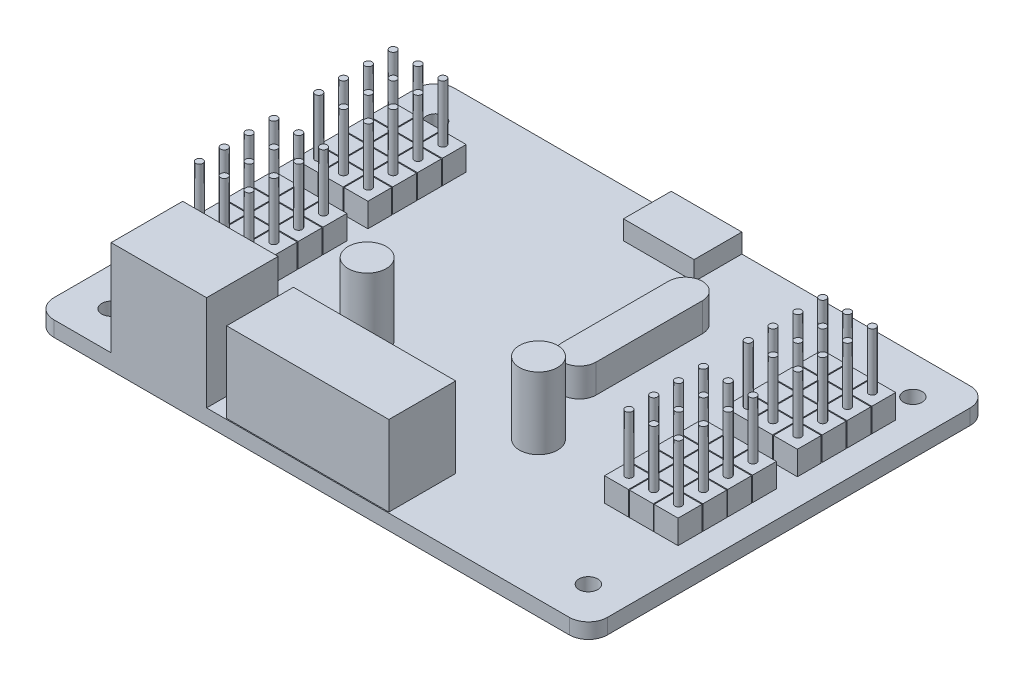
from build123d import *

# Parameters (mm, degrees)
SKETCH_1_W                  = 58
SKETCH_1_H                  = 42
EXTRUDE_1_DEPTH             = 1.6
SKETCH_2_W                  = 10
SKETCH_2_H                  = 7.5
EXTRUDE_2_DEPTH             = 10
SKETCH_4_W                  = 17
SKETCH_4_H                  = 7
EXTRUDE_3_DEPTH             = 8.4
SKETCH_5_R                  = 0.978239546
CUT_EXTRUDE_1_DEPTH         = 73.30490993
FILLET_1_R                  = 2
SKETCH_6_W                  = 7.4
SKETCH_6_H                  = 5
EXTRUDE_4_DEPTH             = 2
SKETCH_7_W                  = 2.5
SKETCH_7_H                  = 2.5
EXTRUDE_5_DEPTH             = 2.5
PATTERN_LINEAR_1_COUNT      = 2
PATTERN_LINEAR_1_PITCH      = 45
PATTERN_LINEAR_1_COUNT_DIR2 = 2
PATTERN_LINEAR_1_PITCH_DIR2 = 12.5
SKETCH_8_R                  = 0.375
EXTRUDE_6_DEPTH             = 6
PATTERN_LINEAR_2_COUNT      = 2
PATTERN_LINEAR_2_PITCH      = 45
PATTERN_LINEAR_2_COUNT_DIR2 = 2
PATTERN_LINEAR_2_PITCH_DIR2 = 12.5
SKETCH_9_R                  = 2
EXTRUDE_7_DEPTH             = 7.5
EXTRUDE_8_DEPTH             = 3
SKETCH_11_W                 = 44.835489636
SKETCH_11_H                 = 29.304241592
EXTRUDE_9_DEPTH             = 1.6


with BuildPart() as part:
    # 草图1 → 凸台-拉伸1 (new body)
    with BuildSketch(Plane(origin=(0, 0, 0), x_dir=(1, 0, 0), z_dir=(0, 1, 0))):
        with Locations((29, 21)):
            Rectangle(SKETCH_1_W, SKETCH_1_H)
    extrude(amount=EXTRUDE_1_DEPTH)

    # 草图2 → 凸台-拉伸2 (add)
    with BuildSketch(Plane(origin=(0, 1.6, 0), x_dir=(1, 0, 0), z_dir=(0, 1, 0))):
        with Locations((13, 3.75)):
            Rectangle(SKETCH_2_W, SKETCH_2_H)
    extrude(amount=EXTRUDE_2_DEPTH)

    # 草图4 → 凸台-拉伸3 (add)
    with BuildSketch(Plane(origin=(0, 1.6, 0), x_dir=(1, 0, 0), z_dir=(0, 1, 0))):
        with Locations((28.5, 3.6)):
            Rectangle(SKETCH_4_W, SKETCH_4_H)
    extrude(amount=EXTRUDE_3_DEPTH)

    # 草图5 → 切除-拉伸1 (cut, through all)
    with BuildSketch(Plane(origin=(0, 1.6, 0), x_dir=(1, 0, 0), z_dir=(0, 1, 0))):
        with Locations(Location((4, 38, 0), (0, 0, 270))):
            Circle(SKETCH_5_R)
        with Locations(Location((54, 38, 0), (0, 0, 90))):
            Circle(SKETCH_5_R)
        with Locations(Location((54, 4, 0), (0, 0, 270))):
            Circle(SKETCH_5_R)
        with Locations(Location((4, 4, 0), (0, 0, 90))):
            Circle(SKETCH_5_R)
    extrude(amount=-CUT_EXTRUDE_1_DEPTH, mode=Mode.SUBTRACT)

    # 圆角1
    fillet_1_edges = [part.edges().sort_by_distance(p)[0] for p in [
        (0, 0.8, -42),
        (58, 0.8, -42),
        (58, 0.8, 0),
        (0, 0.8, 0),
    ]]
    fillet(fillet_1_edges, radius=FILLET_1_R)

    # 草图6 → 凸台-拉伸4 (add)
    with BuildSketch(Plane(origin=(0, 1.6, 0), x_dir=(1, 0, 0), z_dir=(0, 1, 0))):
        with Locations((28.38022734, 39.5)):
            Rectangle(SKETCH_6_W, SKETCH_6_H)
    extrude(amount=EXTRUDE_4_DEPTH)

    # 草图7 → 凸台-拉伸5 (add)
    with BuildSketch(Plane(origin=(0, 1.6, 0), x_dir=(1, 0, 0), z_dir=(0, 1, 0))):
        with Locations((3.75, 33.75)):
            Rectangle(SKETCH_7_W, SKETCH_7_H)
        with Locations((6.35, 33.75)):
            Rectangle(SKETCH_7_W, SKETCH_7_H)
        with Locations((8.95, 33.75)):
            Rectangle(SKETCH_7_W, SKETCH_7_H)
        with Locations((6.35, 31.15)):
            Rectangle(SKETCH_7_W, SKETCH_7_H)
        with Locations((8.95, 31.15)):
            Rectangle(SKETCH_7_W, SKETCH_7_H)
        with Locations((6.35, 28.55)):
            Rectangle(SKETCH_7_W, SKETCH_7_H)
        with Locations((8.95, 28.55)):
            Rectangle(SKETCH_7_W, SKETCH_7_H)
        with Locations((6.35, 25.95)):
            Rectangle(SKETCH_7_W, SKETCH_7_H)
        with Locations((8.95, 25.95)):
            Rectangle(SKETCH_7_W, SKETCH_7_H)
        with Locations((3.75, 31.15)):
            Rectangle(SKETCH_7_W, SKETCH_7_H)
        with Locations((3.75, 28.55)):
            Rectangle(SKETCH_7_W, SKETCH_7_H)
        with Locations((3.75, 25.95)):
            Rectangle(SKETCH_7_W, SKETCH_7_H)
    extrude_5 = extrude(amount=EXTRUDE_5_DEPTH)

    # 阵列(线性)1: Extrude 5 2 × 2
    with Locations(*[(i * PATTERN_LINEAR_1_PITCH, 0, j * PATTERN_LINEAR_1_PITCH_DIR2) for i in range(PATTERN_LINEAR_1_COUNT) for j in range(PATTERN_LINEAR_1_COUNT_DIR2) if (i, j) != (0, 0)]):
        add(extrude_5)

    # 草图8 → 凸台-拉伸6 (add)
    with BuildSketch(Plane(origin=(0, 4.1, 0), x_dir=(1, 0, 0), z_dir=(0, 1, 0))):
        with Locations(Location((3.75, 33.802001605, 0), (0, 0, 270))):
            Circle(SKETCH_8_R)
        with Locations(Location((6.35, 33.802001605, 0), (0, 0, 270))):
            Circle(SKETCH_8_R)
        with Locations(Location((8.95, 33.802001605, 0), (0, 0, 270))):
            Circle(SKETCH_8_R)
        with Locations(Location((6.35, 31.202001605, 0), (0, 0, 270))):
            Circle(SKETCH_8_R)
        with Locations(Location((8.95, 31.202001605, 0), (0, 0, 270))):
            Circle(SKETCH_8_R)
        with Locations(Location((6.35, 28.602001605, 0), (0, 0, 270))):
            Circle(SKETCH_8_R)
        with Locations(Location((8.95, 28.602001605, 0), (0, 0, 270))):
            Circle(SKETCH_8_R)
        with Locations(Location((6.35, 26.002001605, 0), (0, 0, 270))):
            Circle(SKETCH_8_R)
        with Locations(Location((8.95, 26.002001605, 0), (0, 0, 270))):
            Circle(SKETCH_8_R)
        with Locations(Location((3.75, 31.202001605, 0), (0, 0, 270))):
            Circle(SKETCH_8_R)
        with Locations(Location((3.75, 28.602001605, 0), (0, 0, 270))):
            Circle(SKETCH_8_R)
        with Locations(Location((3.75, 26.002001605, 0), (0, 0, 270))):
            Circle(SKETCH_8_R)
    extrude_6 = extrude(amount=EXTRUDE_6_DEPTH)

    # 阵列(线性)2: Extrude 6 2 × 2
    with Locations(*[(i * PATTERN_LINEAR_2_PITCH, 0, j * PATTERN_LINEAR_2_PITCH_DIR2) for i in range(PATTERN_LINEAR_2_COUNT) for j in range(PATTERN_LINEAR_2_COUNT_DIR2) if (i, j) != (0, 0)]):
        add(extrude_6)

    # 草图9 → 凸台-拉伸7 (add)
    with BuildSketch(Plane(origin=(0, 1.6, 0), x_dir=(1, 0, 0), z_dir=(0, 1, 0))):
        with Locations(Location((20.268031761, 14.557883572, 0), (0, 0, 90))):
            Circle(SKETCH_9_R)
        with Locations(Location((38.220469959, 14.557883572, 0), (0, 0, 90))):
            Circle(SKETCH_9_R)
    extrude(amount=EXTRUDE_7_DEPTH)

    # 草图10 → 凸台-拉伸8 (add)
    with BuildSketch(Plane(origin=(0, 1.6, 0), x_dir=(1, 0, 0), z_dir=(0, 1, 0))):
        with BuildLine():
            Line((33.701829052, 21.580095792), (33.701829052, 32.693509915))
            ThreePointArc((33.701829052, 32.693509915), (35.472647786, 34.464328649), (37.24346652, 32.693509915))
            Line((37.24346652, 32.693509915), (37.24346652, 21.580095792))
            ThreePointArc((37.24346652, 21.580095792), (35.472647786, 19.809277058), (33.701829052, 21.580095792))
        make_face()
    extrude(amount=EXTRUDE_8_DEPTH)

    # 草图11 → 凸台-拉伸9 (add)
    with BuildSketch(Plane.XZ):
        with Locations((28.853478792, -20.120872752)):
            Rectangle(SKETCH_11_W, SKETCH_11_H)
    extrude(amount=EXTRUDE_9_DEPTH)


solid = part.part
